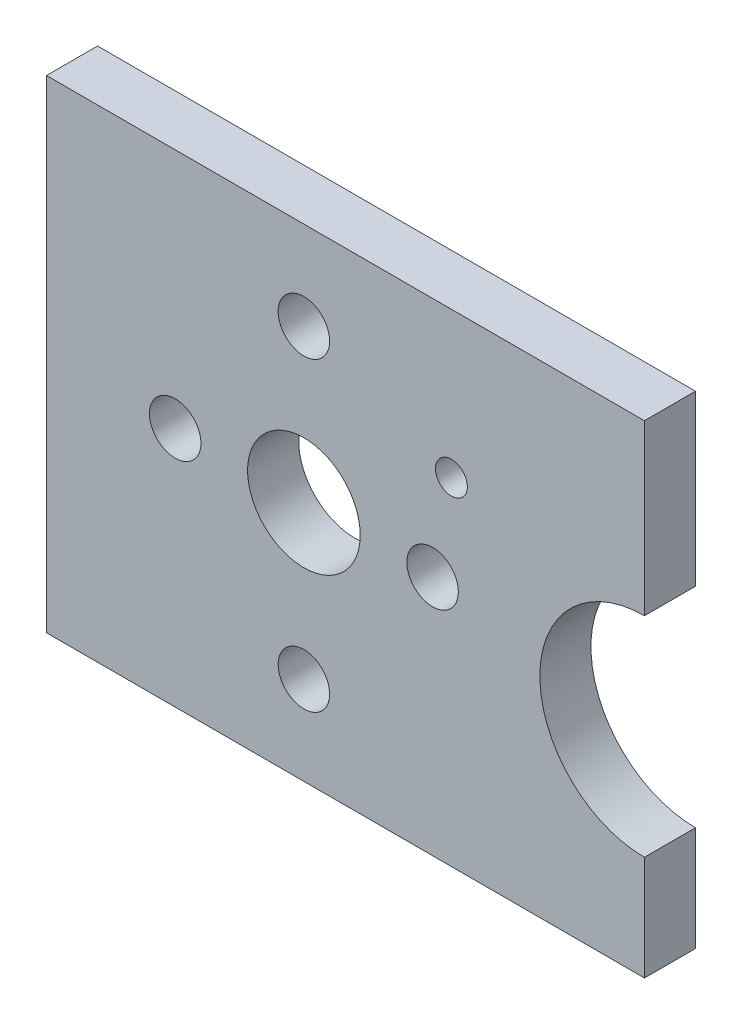
from build123d import *

# Parameters (mm, degrees)
SKETCH1_R           = 0.9906
SKETCH1_R_2         = 1.6
SKETCH1_R_3         = 3.5
BOSS_EXTRUDE2_DEPTH = 3.175


with BuildPart() as part:
    # Sketch1 → Boss-Extrude2 (new body)
    with BuildSketch(Plane.XY):
        with BuildLine():
            Line((0, 0), (37.166699296, 0))
            Line((37.166699296, 0), (37.166699296, 6.5))
            ThreePointArc((37.166699296, 6.5), (30.666699296, 13), (37.166699296, 19.5))
            Line((37.166699296, 19.5), (37.166699296, 30))
            Line((37.166699296, 30), (0, 30))
            Line((0, 30), (0, 0))
        make_face()
        with Locations((25.169778966, 20.933400182)):
            Circle(SKETCH1_R, mode=Mode.SUBTRACT)
        with Locations((16, 24.5)):
            Circle(SKETCH1_R_2, mode=Mode.SUBTRACT)
        with Locations((24, 15)):
            Circle(SKETCH1_R_2, mode=Mode.SUBTRACT)
        with Locations(Location((16, 5.5, 0), (0, 0, 180))):
            Circle(SKETCH1_R_2, mode=Mode.SUBTRACT)
        with Locations(Location((8, 15, 0), (0, 0, 180))):
            Circle(SKETCH1_R_2, mode=Mode.SUBTRACT)
        with Locations((16, 15)):
            Circle(SKETCH1_R_3, mode=Mode.SUBTRACT)
    extrude(amount=BOSS_EXTRUDE2_DEPTH)


solid = part.part
